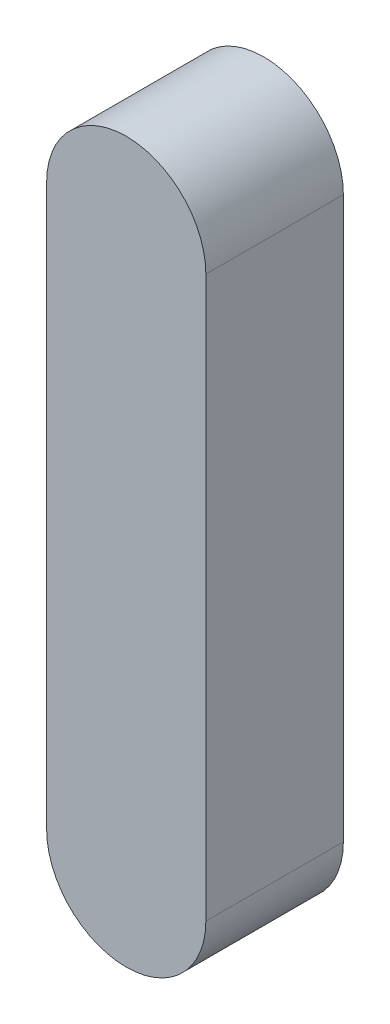
from build123d import *

# Parameters (mm, degrees)
STEM_BLOCK_EXTRUDE_DEPTH      = 55
STEM_BLOCK_EXTRUDE_DEPTH_BACK = 55


with BuildPart() as part:
    # Stem Block Sketch → Stem Block Extrude (new, two sides: drawn at the far end of the back side and taken through both)
    with BuildSketch(Plane.XY.offset(-STEM_BLOCK_EXTRUDE_DEPTH_BACK)):
        with BuildLine():
            Line((-63.676496843, 0), (-63.676496843, 448.256550032))
            ThreePointArc((-63.676496843, 448.256550032), (0, 511.933046875), (63.676496843, 448.256550032))
            Line((63.676496843, 448.256550032), (63.676496843, 0))
            ThreePointArc((63.676496843, 0), (0, -63.676496843), (-63.676496843, 0))
        make_face()
    extrude(amount=STEM_BLOCK_EXTRUDE_DEPTH + STEM_BLOCK_EXTRUDE_DEPTH_BACK)


solid = part.part
